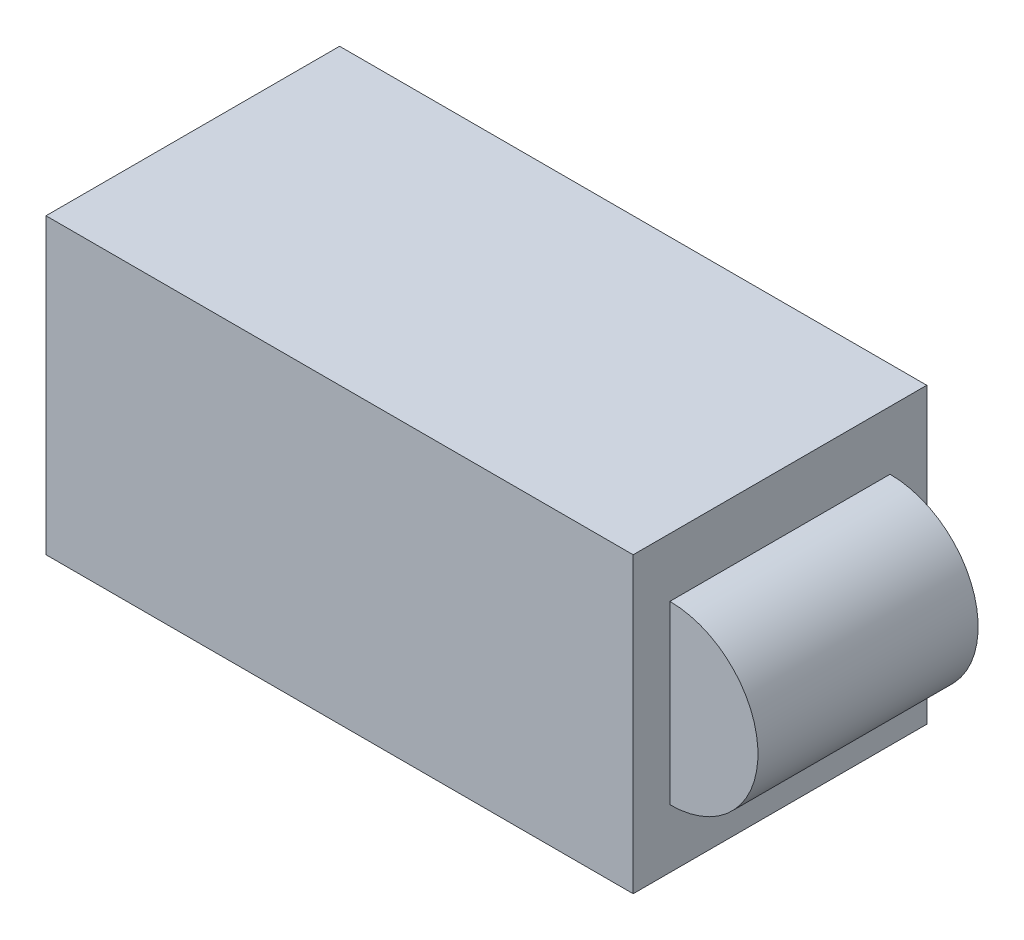
from build123d import *

# Parameters (mm, degrees)
SKETCH1_W           = 40
SKETCH1_H           = 20
BOSS_EXTRUDE1_DEPTH = 10
SKETCH2_R           = 6
BOSS_EXTRUDE2_DEPTH = 7.5


with BuildPart() as part:
    # Sketch1 → Boss-Extrude1 (new, symmetric)
    with BuildSketch(Plane.XY):
        with Locations((20, 10)):
            Rectangle(SKETCH1_W, SKETCH1_H)
    extrude(amount=BOSS_EXTRUDE1_DEPTH, both=True)

    # Sketch2 → Boss-Extrude2 (add, symmetric)
    with BuildSketch(Plane.XY):
        with Locations((40, 10)):
            Circle(SKETCH2_R)
    extrude(amount=BOSS_EXTRUDE2_DEPTH, both=True)


solid = part.part
